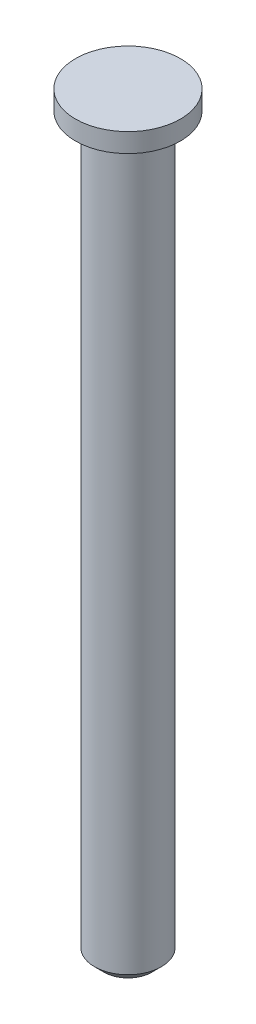
from build123d import *

# Parameters (mm, degrees)
CHAMFER_1_SIZE = 1


with BuildPart() as part:
    # Эскиз1 → Повернуть1 (revolve)
    with BuildSketch(Plane.XY, mode=Mode.PRIVATE) as revolve_1_sk:
        Polygon((0, 39.5), (-5.5, 39.5), (-5.5, 37.5), (-3.5, 37.5), (-3.5, -39.5), (0, -39.5), align=None)
    revolve(revolve_1_sk.sketch.rotate(Axis((0, 68.716811752, 0), (0, -1, 0)), 270), axis=Axis((0, 68.716811752, 0), (0, -1, 0)))

    # Фаска1
    chamfer_1_edges = [part.edges().sort_by_distance(p)[0] for p in [
        (0, -39.5, -3.5),
    ]]
    chamfer(chamfer_1_edges, length=CHAMFER_1_SIZE)


solid = part.part
